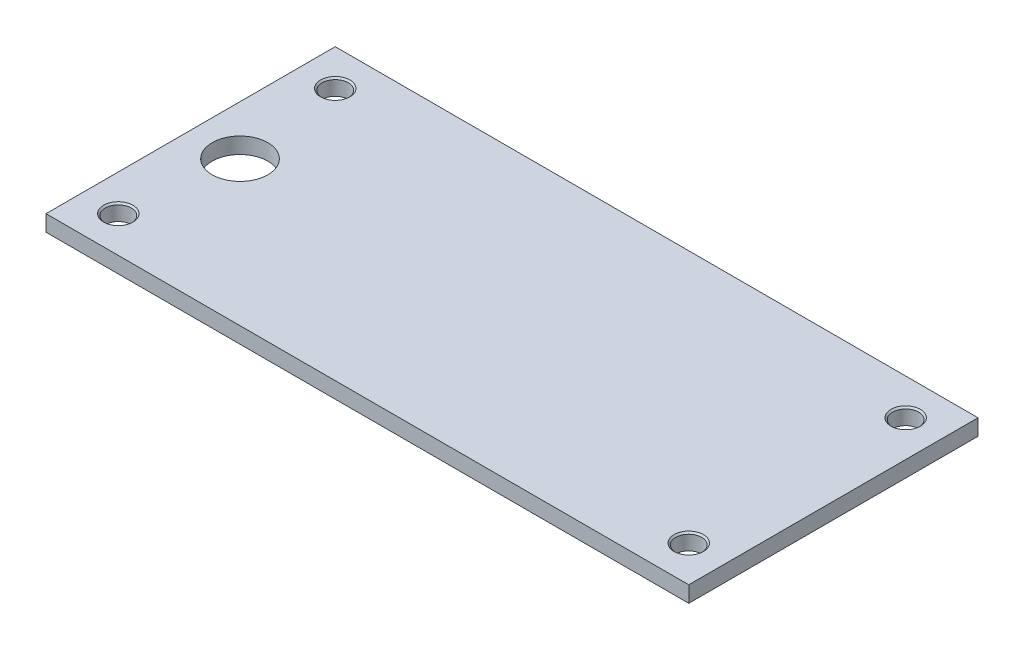
from build123d import *

# Parameters (mm, degrees)
SKETCH1_W                         = 254
SKETCH1_H                         = 114.3
BOSS_EXTRUDE1_DEPTH               = 6.35
SKETCH2_R                         = 11
CUT_EXTRUDE1_DEPTH                = 140.411064841
F_3_8_CLEARANCE_HOLE1_D           = 10.31748
F_3_8_CLEARANCE_HOLE1_CSINK_D     = 11.58748
F_3_8_CLEARANCE_HOLE1_CSINK_ANGLE = 90


with BuildPart() as part:
    # Sketch1 → Boss-Extrude1 (new body)
    with BuildSketch(Plane(origin=(0, 0, 0), x_dir=(1, 0, 0), z_dir=(0, 1, 0))):
        Rectangle(SKETCH1_W, SKETCH1_H)
    extrude(amount=BOSS_EXTRUDE1_DEPTH)

    # Sketch2 → Cut-Extrude1 (cut, through all)
    with BuildSketch(Plane(origin=(0, 6.35, 0), x_dir=(1, 0, 0), z_dir=(0, 1, 0))):
        with Locations(Location((-107.475, 0, 0), (0, 0, 270))):
            Circle(SKETCH2_R)
    extrude(amount=-CUT_EXTRUDE1_DEPTH, mode=Mode.SUBTRACT)

    # 3/8 Clearance Hole1 (through all)
    with Locations(Plane(origin=(0, 6.35, 0), x_dir=(1, 0, 0), z_dir=(0, 1, 0))):
        with Locations((112.7125, 42.8625), (112.7125, -42.8675), (-112.7175, -42.8675), (-112.7175, 42.8625)):
            CounterSinkHole(F_3_8_CLEARANCE_HOLE1_D / 2, F_3_8_CLEARANCE_HOLE1_CSINK_D / 2, counter_sink_angle=F_3_8_CLEARANCE_HOLE1_CSINK_ANGLE)


solid = part.part
